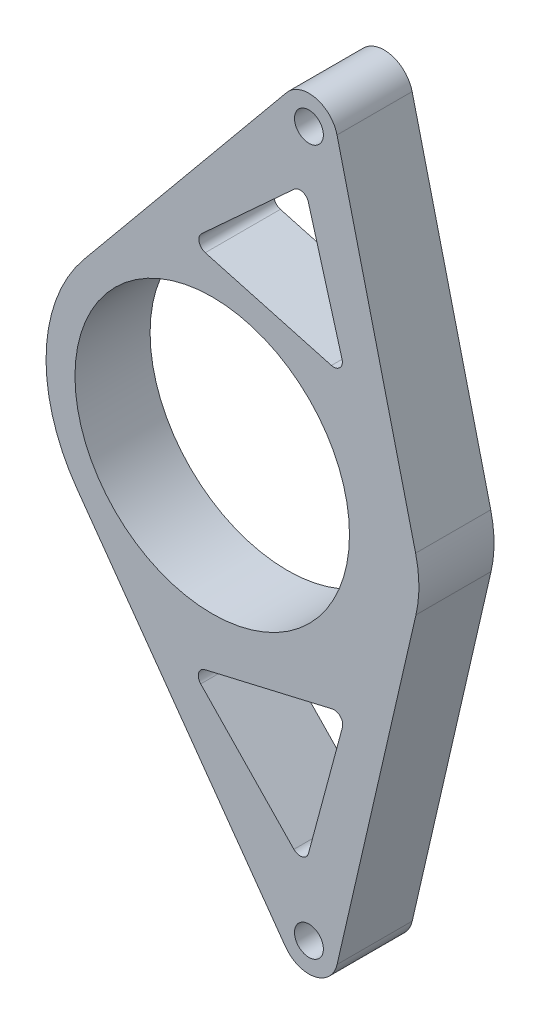
from build123d import *

# Parameters (mm, degrees)
SKETCH2_R           = 47.5
SKETCH2_R_2         = 5
BOSS_EXTRUDE2_DEPTH = 26
CUT_EXTRUDE1_DEPTH  = 26


with BuildPart() as part:
    # Sketch2 → Boss-Extrude2 (new body)
    with BuildSketch(Plane.XY):
        with BuildLine():
            Line((-44.361418341, 36.582981874), (25.749824557, 121.601589362))
            ThreePointArc((25.749824557, 121.601589362), (35.699764064, 124.986391522), (43.181062365, 117.604768557))
            Line((43.181062365, 117.604768557), (70.382008245, 5.874854744))
            ThreePointArc((70.382008245, 5.874854744), (71.516417726, -3.340902868), (70.495441136, -12.569915818))
            Line((70.495441136, -12.569915818), (43.209420588, -130.966785703))
            ThreePointArc((43.209420588, -130.966785703), (35.417472002, -138.528541499), (25.323491774, -134.527769491))
            Line((25.323491774, -134.527769491), (-46.812831844, -33.388752219))
            ThreePointArc((-46.812831844, -33.388752219), (-57.464744559, 2.013239383), (-44.361418341, 36.582981874))
        make_face()
        with Locations(Location((0, 0, 0), (0, 0, 180))):
            Circle(SKETCH2_R, mode=Mode.SUBTRACT)
        with Locations(Location((33.464853834, 115.239331644, 0), (0, 0, 180))):
            Circle(SKETCH2_R_2, mode=Mode.SUBTRACT)
        with Locations(Location((33.464853834, -128.721029975, 0), (0, 0, 180))):
            Circle(SKETCH2_R_2, mode=Mode.SUBTRACT)
    extrude(amount=BOSS_EXTRUDE2_DEPTH)

    # Sketch3 → Cut-Extrude1 (cut)
    with BuildSketch(Plane(origin=(0, 0, 0), x_dir=(-1, 0, 0), z_dir=(0, 0, -1))):
        with BuildLine():
            Line((-33.26004361, 92.533263855), (-44.920341747, 51.273747369))
            ThreePointArc((-44.920341747, 51.273747369), (-44.16321834, 48.345074539), (-41.240708097, 47.564501493))
            Line((-41.240708097, 47.564501493), (2.410664417, 59.523781634))
            ThreePointArc((2.410664417, 59.523781634), (4.534059271, 61.712628945), (3.644196413, 64.629476961))
            Line((3.644196413, 64.629476961), (-28.346877964, 93.929713306))
            ThreePointArc((-28.346877964, 93.929713306), (-31.193307402, 94.603096407), (-33.26004361, 92.533263855))
        make_face()
        with BuildLine():
            Line((-41.486917876, -55.239236277), (2.503698589, -65.483626413))
            ThreePointArc((2.503698589, -65.483626413), (4.700165382, -67.55485567), (3.983155181, -70.48749158))
            Line((3.983155181, -70.48749158), (-28.256543188, -103.932412317))
            ThreePointArc((-28.256543188, -103.932412317), (-31.16488904, -104.755498955), (-33.313463379, -102.629569624))
            Line((-33.313463379, -102.629569624), (-45.064381475, -58.940258751))
            ThreePointArc((-45.064381475, -58.940258751), (-44.32436227, -56.076046257), (-41.486917876, -55.239236277))
        make_face()
    extrude(amount=-CUT_EXTRUDE1_DEPTH, mode=Mode.SUBTRACT)


solid = part.part
